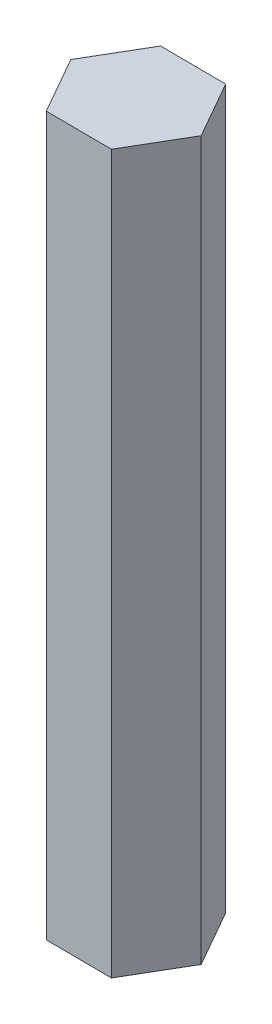
from build123d import *

# Parameters (mm, degrees)
BOSS_EXTRUDE1_DEPTH = 104


with BuildPart() as part:
    # Sketch1 → Boss-Extrude1 (new body)
    with BuildSketch(Plane(origin=(0, 0, 0), x_dir=(1, 0, 0), z_dir=(0, 1, 0))):
        Polygon((4.800847805, 8.197674082), (-4.698970104, 8.2564932), (-9.499817909, 0.058819118), (-4.800847805, -8.197674082), (4.698970104, -8.2564932), (9.499817909, -0.058819118), align=None)
    extrude(amount=BOSS_EXTRUDE1_DEPTH)


solid = part.part
